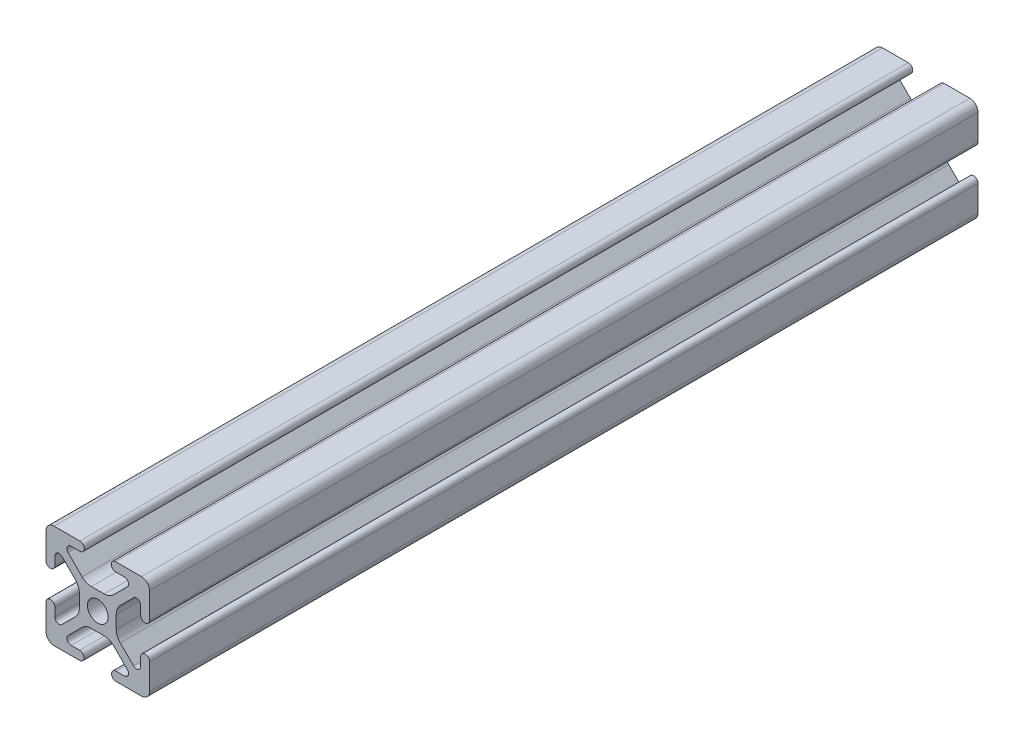
from build123d import *

# Parameters (mm, degrees)
SKETCH1_R           = 2.5
BOSS_EXTRUDE1_DEPTH = 200


with BuildPart() as part:
    # Sketch1 → Boss-Extrude1 (new body)
    with BuildSketch(Plane(origin=(0, 0, -4000), x_dir=(-1, 0, 0), z_dir=(0, 0, -1))):
        with BuildLine():
            Line((12.5, 4.32), (12.5, 10.537068835))
            ThreePointArc((12.5, 10.537068835), (11.925070773, 11.925070773), (10.537068835, 12.5))
            Line((10.537068835, 12.5), (4.32, 12.5))
            ThreePointArc((4.32, 12.5), (3.25, 11.43), (4.32, 10.36))
            Line((4.32, 10.36), (6.42, 10.36))
            ThreePointArc((6.42, 10.36), (7.35325999, 9.736168088), (7.133653911, 8.635298598))
            Line((7.133653911, 8.635298598), (3.795290766, 5.301828272))
            ThreePointArc((3.795290766, 5.301828272), (2.76743922, 4.61585726), (1.555406707, 4.375))
            Line((1.555406707, 4.375), (-1.555406707, 4.375))
            ThreePointArc((-1.555406707, 4.375), (-2.76743922, 4.61585726), (-3.795290766, 5.301828272))
            Line((-3.795290766, 5.301828272), (-7.133653912, 8.635298598))
            ThreePointArc((-7.133653912, 8.635298598), (-7.35325999, 9.736168088), (-6.42, 10.36))
            Line((-6.42, 10.36), (-4.32, 10.36))
            ThreePointArc((-4.32, 10.36), (-3.25, 11.43), (-4.32, 12.5))
            Line((-4.32, 12.5), (-10.537068835, 12.5))
            ThreePointArc((-10.537068835, 12.5), (-11.925070773, 11.925070773), (-12.5, 10.537068835))
            Line((-12.5, 10.537068835), (-12.5, 4.32))
            ThreePointArc((-12.5, 4.32), (-11.43, 3.25), (-10.36, 4.32))
            Line((-10.36, 4.32), (-10.36, 6.396886949))
            ThreePointArc((-10.36, 6.396886949), (-9.736852394, 7.329863489), (-8.636346088, 7.111588351))
            Line((-8.636346088, 7.111588351), (-5.432204773, 3.912143135))
            ThreePointArc((-5.432204773, 3.912143135), (-4.708985779, 2.831057106), (-4.455, 1.555406707))
            Line((-4.455, 1.555406707), (-4.455, -1.555406707))
            ThreePointArc((-4.455, -1.555406707), (-4.708985779, -2.831057106), (-5.432204773, -3.912143135))
            Line((-5.432204773, -3.912143135), (-8.636346088, -7.111588351))
            ThreePointArc((-8.636346088, -7.111588351), (-9.736852394, -7.329863489), (-10.36, -6.396886949))
            Line((-10.36, -6.396886949), (-10.36, -4.32))
            ThreePointArc((-10.36, -4.32), (-11.43, -3.25), (-12.5, -4.32))
            Line((-12.5, -4.32), (-12.5, -10.537068835))
            ThreePointArc((-12.5, -10.537068835), (-11.925070773, -11.925070773), (-10.537068835, -12.5))
            Line((-10.537068835, -12.5), (-4.387856959, -12.5))
            ThreePointArc((-4.387856959, -12.5), (-3.317856959, -11.43), (-4.387856959, -10.36))
            Line((-4.387856959, -10.36), (-6.42, -10.36))
            ThreePointArc((-6.42, -10.36), (-7.35325999, -9.736168088), (-7.133653912, -8.635298598))
            Line((-7.133653912, -8.635298598), (-3.795290766, -5.301828272))
            ThreePointArc((-3.795290766, -5.301828272), (-2.76743922, -4.61585726), (-1.555406707, -4.375))
            Line((-1.555406707, -4.375), (1.555406707, -4.375))
            ThreePointArc((1.555406707, -4.375), (2.76743922, -4.61585726), (3.795290766, -5.301828272))
            Line((3.795290766, -5.301828272), (7.133653912, -8.635298598))
            ThreePointArc((7.133653912, -8.635298598), (7.35325999, -9.736168088), (6.42, -10.36))
            Line((6.42, -10.36), (4.387856959, -10.36))
            ThreePointArc((4.387856959, -10.36), (3.317856959, -11.43), (4.387856959, -12.5))
            Line((4.387856959, -12.5), (10.537068835, -12.5))
            ThreePointArc((10.537068835, -12.5), (11.925070773, -11.925070773), (12.5, -10.537068835))
            Line((12.5, -10.537068835), (12.5, -4.32))
            ThreePointArc((12.5, -4.32), (11.43, -3.25), (10.36, -4.32))
            Line((10.36, -4.32), (10.36, -6.396886949))
            ThreePointArc((10.36, -6.396886949), (9.736852394, -7.329863489), (8.636346088, -7.111588351))
            Line((8.636346088, -7.111588351), (5.432204773, -3.912143135))
            ThreePointArc((5.432204773, -3.912143135), (4.708985779, -2.831057106), (4.455, -1.555406707))
            Line((4.455, -1.555406707), (4.455, 1.555406707))
            ThreePointArc((4.455, 1.555406707), (4.708985779, 2.831057106), (5.432204773, 3.912143135))
            Line((5.432204773, 3.912143135), (8.636346088, 7.111588351))
            ThreePointArc((8.636346088, 7.111588351), (9.736852394, 7.329863489), (10.36, 6.396886949))
            Line((10.36, 6.396886949), (10.36, 4.32))
            ThreePointArc((10.36, 4.32), (11.43, 3.25), (12.5, 4.32))
        make_face()
        with Locations(Location((0, 0, 0), (0, 0, 180))):
            Circle(SKETCH1_R, mode=Mode.SUBTRACT)
    extrude(amount=-BOSS_EXTRUDE1_DEPTH)


solid = part.part
